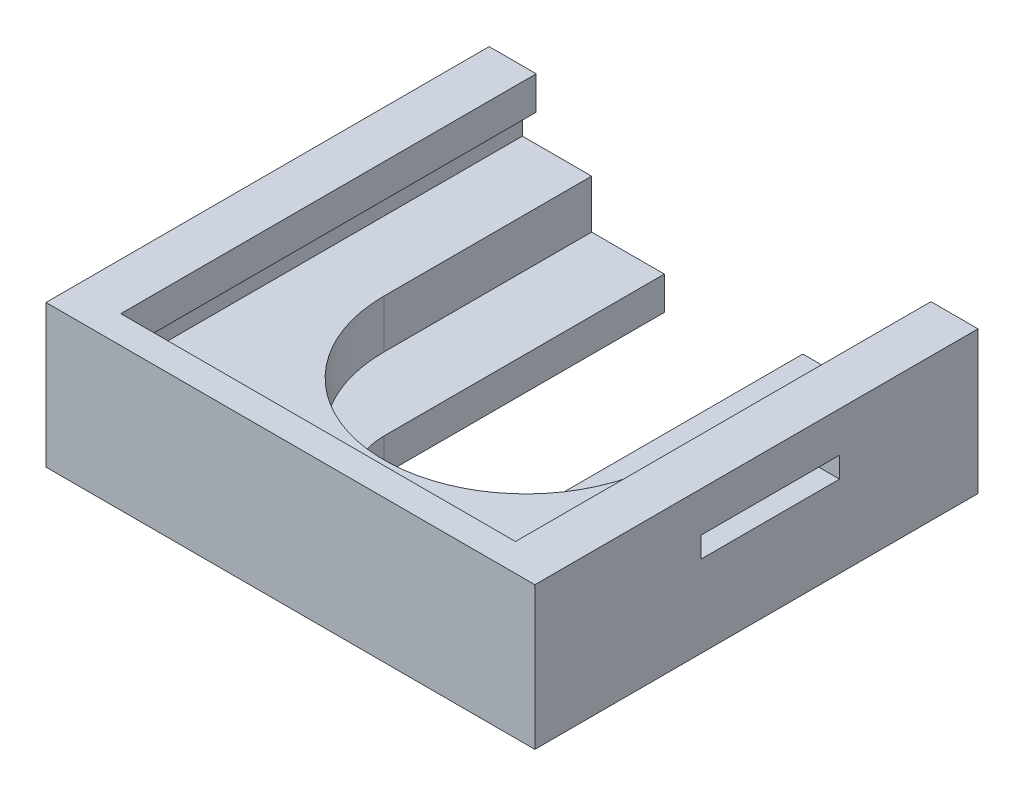
from build123d import *

# Parameters (mm, degrees)
SALIENTE_EXTRUIR1_DEPTH = 30
CORTAR_EXTRUIR1_DEPTH   = 3.5
CORTAR_EXTRUIR2_DEPTH   = 46.219685979
CROQUIS4_W              = 10
CROQUIS4_H              = 1.5
CORTAR_EXTRUIR3_DEPTH   = 3.5
CROQUIS5_W              = 35.3
CROQUIS5_H              = 10.3
SALIENTE_EXTRUIR2_DEPTH = 2


with BuildPart() as part:
    # Croquis1 → Saliente-Extruir1 (new body)
    with BuildSketch(Plane.XY):
        Polygon((0, 0), (30.5, 0), (30.5, 2), (29.5, 2), (29.5, 4.4), (32.9, 4.4), (32.9, -5.9), (-2.4, -5.9), (-2.4, 4.4), (1, 4.4), (1, 2), (0, 2), align=None)
    extrude(amount=SALIENTE_EXTRUIR1_DEPTH)

    # Croquis2 → Cortar-Extruir1 (cut)
    with BuildSketch(Plane(origin=(0, 0, 0), x_dir=(1, 0, 0), z_dir=(0, 1, 0))):
        with BuildLine():
            Line((5, -15), (5, 0))
            Line((5, 0), (25.5, 0))
            Line((25.5, 0), (25.5, -15))
            ThreePointArc((25.5, -15), (15.25, -25.25), (5, -15))
        make_face()
    extrude(amount=-CORTAR_EXTRUIR1_DEPTH, mode=Mode.SUBTRACT)

    # Croquis3 → Cortar-Extruir2 (cut, through all)
    with BuildSketch(Plane(origin=(0, -3.5, 0), x_dir=(1, 0, 0), z_dir=(0, 1, 0))):
        with BuildLine():
            Line((10.25, -20.25), (10.25, 0))
            Line((10.25, 0), (20.25, 0))
            Line((20.25, 0), (20.25, -20.25))
            ThreePointArc((20.25, -20.25), (15.25, -25.25), (10.25, -20.25))
        make_face()
    extrude(amount=-CORTAR_EXTRUIR2_DEPTH, mode=Mode.SUBTRACT)

    # Croquis4 → Cortar-Extruir3 (cut)
    with BuildSketch(Plane.ZY.offset(-30.5)):
        with Locations((15, 0.75)):
            Rectangle(CROQUIS4_W, CROQUIS4_H)
    extrude(amount=-CORTAR_EXTRUIR3_DEPTH, mode=Mode.SUBTRACT)

    # Croquis5 → Saliente-Extruir2 (add)
    with BuildSketch(Plane.XY.offset(30)):
        with Locations((15.25, -0.75)):
            Rectangle(CROQUIS5_W, CROQUIS5_H)
    extrude(amount=SALIENTE_EXTRUIR2_DEPTH)


solid = part.part
